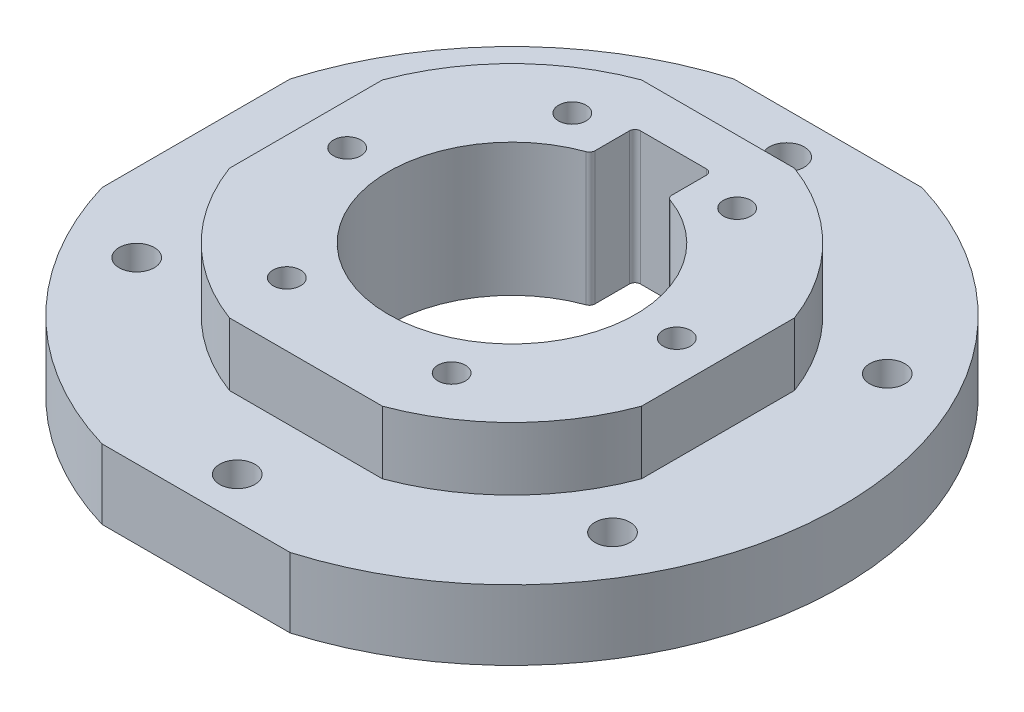
from build123d import *

# Parameters (mm, degrees)
BOSS_EXTRUDE1_DEPTH                  = 12.7
M6_CLEARANCE_HOLE1_D                 = 6.4
BOSS_EXTRUDE2_START                  = 11.45
BOSS_EXTRUDE2_DEPTH                  = 11.45
SKETCH2_W                            = 2.5
SKETCH2_H                            = 12.7
TAP_DRILL_FOR_M6X1_0_TAP1_AT_2_COUNT = 2
TAP_DRILL_FOR_M6X1_0_TAP1_AT_2_PITCH = 30
TAP_DRILL_FOR_M6X1_0_TAP1_AT_3_COUNT = 2
TAP_DRILL_FOR_M6X1_0_TAP1_AT_3_PITCH = 51.961524227
TAP_DRILL_FOR_M6X1_0_TAP1_AT_4_COUNT = 2
TAP_DRILL_FOR_M6X1_0_TAP1_AT_4_PITCH = 60
TAP_DRILL_FOR_M6X1_0_TAP1_AT_5_COUNT = 2
TAP_DRILL_FOR_M6X1_0_TAP1_AT_5_PITCH = 51.961524227
TAP_DRILL_FOR_M6X1_0_TAP1_AT_6_COUNT = 2
TAP_DRILL_FOR_M6X1_0_TAP1_AT_6_PITCH = 30
TAP_DRILL_FOR_M6X1_0_TAP3_D          = 5
FILLET1_R                            = 1


with BuildPart() as part:
    # Sketch1 → Boss-Extrude1 (new body)
    with BuildSketch(Plane(origin=(0, 0, 0), x_dir=(1, 0, 0), z_dir=(0, 1, 0))):
        with BuildLine():
            Line((17.139136501, 57.5), (-17.139136501, 57.5))
            ThreePointArc((-17.139136501, 57.5), (-42.426406871, 42.426406871), (-57.5, 17.139136501))
            Line((-57.5, 17.139136501), (-57.5, -17.139136501))
            ThreePointArc((-57.5, -17.139136501), (-42.426406871, -42.426406871), (-17.139136501, -57.5))
            Line((-17.139136501, -57.5), (17.139136501, -57.5))
            ThreePointArc((17.139136501, -57.5), (60, 0), (17.139136501, 57.5))
        make_face()
        with BuildLine():
            Line((-7, 21.38340478), (-7, 29.38340478))
            Line((-7, 29.38340478), (7, 29.38340478))
            Line((7, 29.38340478), (7, 21.38340478))
            ThreePointArc((7, 21.38340478), (0, -22.5), (-7, 21.38340478))
        make_face(mode=Mode.SUBTRACT)
    extrude(amount=-BOSS_EXTRUDE1_DEPTH)

    # M6 Clearance Hole1 (through all)
    with Locations(Plane(origin=(-43.301270189, 0, 25), x_dir=(0, 0, 1), z_dir=(0, 1, 0))):
        with Locations((0, 0), (-75, 43.301270189), (-50, 86.602540378), (0, 86.602540378), (25, 43.301270189), (-50, 0)):
            Hole(M6_CLEARANCE_HOLE1_D / 2)

    # Sketch1<7> → Boss-Extrude2 (add)
    with BuildSketch(Plane(origin=(0, 0, 0), x_dir=(1, 0, 0), z_dir=(0, 1, 0)).offset(BOSS_EXTRUDE2_START)):
        with BuildLine():
            Line((13.919410907, 37.5), (-13.919410907, 37.5))
            ThreePointArc((-13.919410907, 37.5), (-28.284271247, 28.284271247), (-37.5, 13.919410907))
            Line((-37.5, 13.919410907), (-37.5, -13.919410907))
            ThreePointArc((-37.5, -13.919410907), (-28.284271247, -28.284271247), (-13.919410907, -37.5))
            Line((-13.919410907, -37.5), (13.919410907, -37.5))
            ThreePointArc((13.919410907, -37.5), (28.284271247, -28.284271247), (37.5, -13.919410907))
            Line((37.5, -13.919410907), (37.5, 13.919410907))
            ThreePointArc((37.5, 13.919410907), (28.284271247, 28.284271247), (13.919410907, 37.5))
        make_face()
        with BuildLine():
            ThreePointArc((22.5, 0), (-13.205112646, -18.217436702), (-7, 21.38340478))
            Line((-7, 21.38340478), (-7, 29.38340478))
            Line((-7, 29.38340478), (7, 29.38340478))
            Line((7, 29.38340478), (7, 21.38340478))
            ThreePointArc((7, 21.38340478), (18.217436702, 13.205112646), (22.5, 0))
        make_face(mode=Mode.SUBTRACT)
    extrude(amount=-BOSS_EXTRUDE2_DEPTH)

    # Sketch2 → Tap Drill for M6x1.0 Tap1 (revolve, cut)
    with BuildSketch(Plane(origin=(-30, 0, 0), x_dir=(0, 0, 1), z_dir=(1, 0, 0))):
        with Locations((1.25, 6.35)):
            Rectangle(SKETCH2_W, SKETCH2_H)
    tap_drill_for_m6x1_0_tap1 = revolve(axis=Axis((-30, 6.35, 0), (0, -1, 0)), mode=Mode.SUBTRACT)

    # Tap Drill for M6x1.0 Tap1 at 2: Tap Drill for M6x1.0 Tap1 ×2
    with Locations(*[Vector(0.4999999999999998, 0, -0.8660254037844388) * (i * TAP_DRILL_FOR_M6X1_0_TAP1_AT_2_PITCH) for i in range(1, TAP_DRILL_FOR_M6X1_0_TAP1_AT_2_COUNT)]):
        add(tap_drill_for_m6x1_0_tap1, mode=Mode.SUBTRACT)

    # Tap Drill for M6x1.0 Tap1 at 3: Tap Drill for M6x1.0 Tap1 ×2
    with Locations(*[Vector(0.8660254037844386, 0, -0.5000000000000002) * (i * TAP_DRILL_FOR_M6X1_0_TAP1_AT_3_PITCH) for i in range(1, TAP_DRILL_FOR_M6X1_0_TAP1_AT_3_COUNT)]):
        add(tap_drill_for_m6x1_0_tap1, mode=Mode.SUBTRACT)

    # Tap Drill for M6x1.0 Tap1 at 4: Tap Drill for M6x1.0 Tap1 ×2
    with Locations(*[(i * TAP_DRILL_FOR_M6X1_0_TAP1_AT_4_PITCH, 0, 0) for i in range(1, TAP_DRILL_FOR_M6X1_0_TAP1_AT_4_COUNT)]):
        add(tap_drill_for_m6x1_0_tap1, mode=Mode.SUBTRACT)

    # Tap Drill for M6x1.0 Tap1 at 5: Tap Drill for M6x1.0 Tap1 ×2
    with Locations(*[Vector(0.8660254037844388, 0, 0.49999999999999967) * (i * TAP_DRILL_FOR_M6X1_0_TAP1_AT_5_PITCH) for i in range(1, TAP_DRILL_FOR_M6X1_0_TAP1_AT_5_COUNT)]):
        add(tap_drill_for_m6x1_0_tap1, mode=Mode.SUBTRACT)

    # Tap Drill for M6x1.0 Tap1 at 6: Tap Drill for M6x1.0 Tap1 ×2
    with Locations(*[Vector(0.5000000000000006, 0, 0.8660254037844384) * (i * TAP_DRILL_FOR_M6X1_0_TAP1_AT_6_PITCH) for i in range(1, TAP_DRILL_FOR_M6X1_0_TAP1_AT_6_COUNT)]):
        add(tap_drill_for_m6x1_0_tap1, mode=Mode.SUBTRACT)

    # Tap Drill for M6x1.0 Tap3 (through all)
    with Locations(Plane(origin=(30, 0, 0), x_dir=(0, 0, -1), z_dir=(0, -1, 0))):
        with Locations((0, 0), (25.980762114, -45), (-25.980762114, -15), (0, -60), (-25.980762114, -45), (25.980762114, -15)):
            Hole(TAP_DRILL_FOR_M6X1_0_TAP3_D / 2)

    # Fillet1
    fillet1_edges = [part.edges().sort_by_distance(p)[0] for p in [
        (7, -0.625, -21.38340478),
        (7, -0.625, -29.38340478),
        (-7, -0.625, -29.38340478),
        (-7, -0.625, -21.38340478),
    ]]
    fillet(fillet1_edges, radius=FILLET1_R)


solid = part.part
